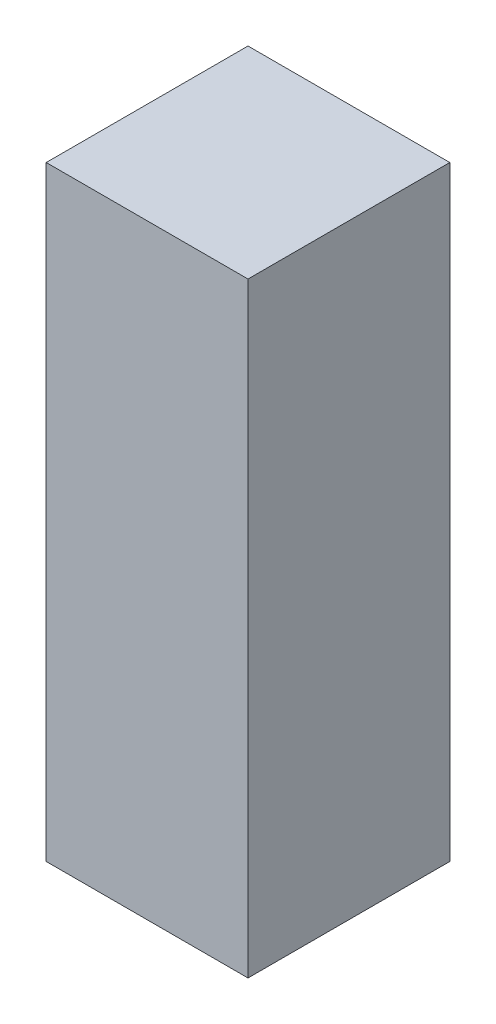
from build123d import *

# Parameters (mm, degrees)
SKETCH_1_W      = 1000
SKETCH_1_H      = 1000
EXTRUDE_1_DEPTH = 3000


with BuildPart() as part:
    # 草图1 → 凸台-拉伸1 (new body)
    with BuildSketch(Plane(origin=(0, 0, 0), x_dir=(1, 0, 0), z_dir=(0, 1, 0))):
        Rectangle(SKETCH_1_W, SKETCH_1_H)
    extrude(amount=EXTRUDE_1_DEPTH)


solid = part.part
